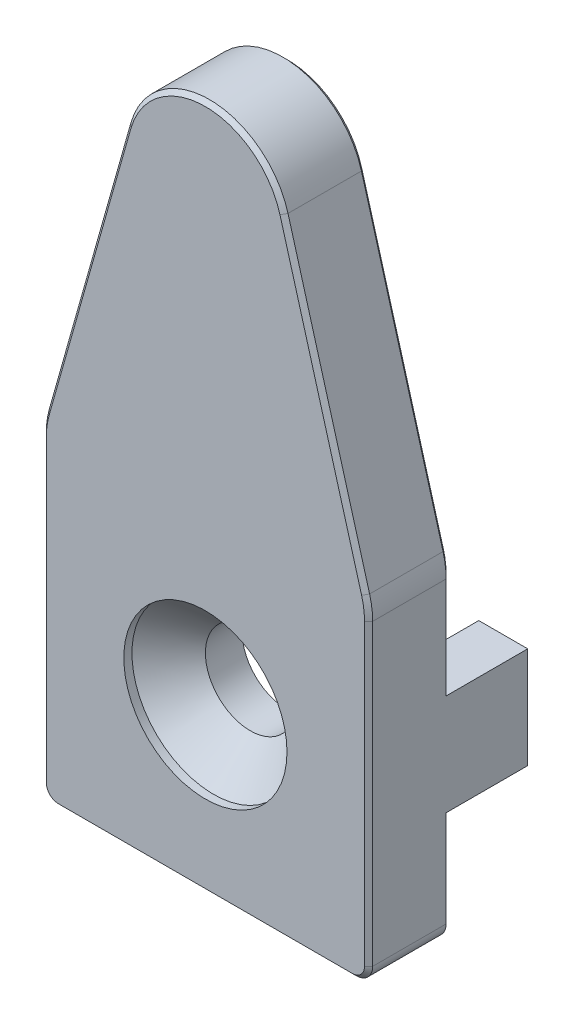
from build123d import *

# Parameters (mm, degrees)
SKETCH1_R           = 5
SKETCH1_R_2         = 2.75
BOSS_EXTRUDE1_DEPTH = 5
SKETCH2_W           = 3
SKETCH2_H           = 6.2
BOSS_EXTRUDE2_DEPTH = 5
FILLET1_R           = 1
FILLET2_R           = 5
CHAMFER1_SIZE       = 0.25


with BuildPart() as part:
    # Sketch1 → Boss-Extrude1 (new body)
    # profile 1 of 2: a face of its own
    with BuildSketch(Plane.XY):
        with Locations((0, 27)):
            Circle(SKETCH1_R)
    # profile 2 of 2: a face of its own
    with BuildSketch(Plane.XY):
        with BuildLine():
            Line((-4.811559492, 28.359740878), (-10, 10))
            Line((-10, 10), (-10, -10))
            Line((-10, -10), (10, -10))
            Line((10, -10), (10, 10))
            Line((10, 10), (4.811559492, 28.359740878))
            ThreePointArc((4.811559492, 28.359740878), (4.952665821, 27.686368174), (5, 27))
            ThreePointArc((5, 27), (-0.686368174, 22.047334179), (-4.811559492, 28.359740878))
        make_face()
        Circle(SKETCH1_R_2, mode=Mode.SUBTRACT)
    extrude(amount=BOSS_EXTRUDE1_DEPTH)

    # Sketch2 → Boss-Extrude2 (add)
    with BuildSketch(Plane(origin=(0, 0, 0), x_dir=(-1, 0, 0), z_dir=(0, 0, -1))):
        with Locations((-8.5, 0)):
            Rectangle(SKETCH2_W, SKETCH2_H)
        with Locations((8.5, 0)):
            Rectangle(SKETCH2_W, SKETCH2_H)
    extrude(amount=BOSS_EXTRUDE2_DEPTH)

    # Fillet1
    fillet1_edges = [part.edges().sort_by_distance(p)[0] for p in [
        (10, -10, 2.5),
        (-10, -10, 2.5),
        (7, 0, 0),
        (-7, 0, 0),
    ]]
    fillet(fillet1_edges, radius=FILLET1_R)

    # Fillet2
    fillet2_edges = [part.edges().sort_by_distance(p)[0] for p in [
        (10, 10, 2.5),
        (-10, 10, 2.5),
    ]]
    fillet(fillet2_edges, radius=FILLET2_R)

    # Sketch4 → CSK for M5 Flat Head Machine Screw1 (revolve, cut)
    with BuildSketch(Plane(origin=(0, 0, 5), x_dir=(0, -1, 0), z_dir=(1, 0, 0))):
        Polygon((0, 0), (0, 10), (2.75, 10), (2.75, 2.75), (5, 0.5), (5, 0), align=None)
    revolve(axis=Axis((0, 0, 11.35), (0, 0, -1)), mode=Mode.SUBTRACT)

    # Chamfer1
    chamfer1_edges = [part.edges().sort_by_distance(p)[0] for p in [
        (-10, 6.203535995, 0),
        (-7.311559492, 19.513276873, 0),
        (10, 6.203535995, 0),
        (-9.952665821, 9.993440164, 0),
        (9.952665821, 9.993440164, 0),
        (10, 0.153535995, 5),
        (-7.311559492, 19.513276873, 5),
        (-10, 0.153535995, 5),
        (-9.952665821, 9.993440164, 5),
        (9.952665821, 9.993440164, 5),
        (0, 32, 0),
        (10, -6.05, 0),
        (-10, -6.05, 0),
        (10, 0, -5),
        (8.5, -3.1, -5),
        (7, 0, -5),
        (8.5, 3.1, -5),
        (-7, 0, -5),
        (-8.5, -3.1, -5),
        (-10, 0, -5),
        (-8.5, 3.1, -5),
        (0, -10, 0),
        (-9.707106781, -9.707106781, 0),
        (9.707106781, -9.707106781, 0),
        (0, -10, 5),
        (0, 32, 5),
        (-9.707106781, -9.707106781, 5),
        (9.707106781, -9.707106781, 5),
        (7.311559492, 19.513276873, 0),
        (7.311559492, 19.513276873, 5),
    ]]
    chamfer(chamfer1_edges, length=CHAMFER1_SIZE)


solid = part.part
